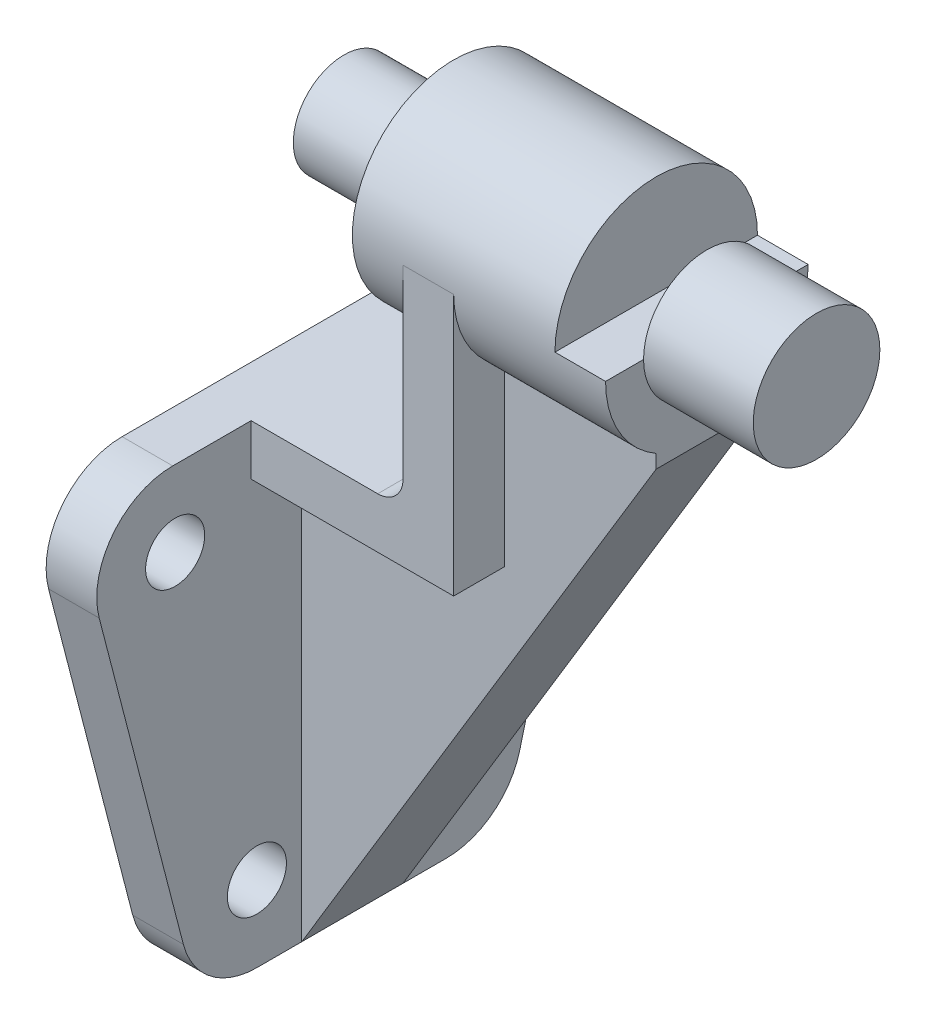
from build123d import *

# Parameters (mm, degrees)
SKETCH1_R                = 7
BOSS_EXTRUDE1_DEPTH      = 12
SKETCH2_R                = 24
BOSS_EXTRUDE2_DEPTH      = 48
BOSS_EXTRUDE3_DEPTH      = 12
SKETCH4_R                = 15
BOSS_EXTRUDE4_DEPTH      = 26
SKETCH5_R                = 12
BOSS_EXTRUDE5_DEPTH      = 26
BOSS_EXTRUDE6_DEPTH      = 24
BOSS_EXTRUDE6_DEPTH_BACK = 24
FILLET2_R                = 6
BOSS_EXTRUDE8_DEPTH      = 12
BOSS_EXTRUDE8_DEPTH_BACK = 12


with BuildPart() as part:
    # Sketch1 → Boss-Extrude1 (new body)
    with BuildSketch(Plane(origin=(0, 0, 0), x_dir=(0, 0, -1), z_dir=(1, 0, 0))):
        with BuildLine():
            Line((-59.995604766, 5.505634955), (-40.05091289, -71.438574032))
            ThreePointArc((-40.05091289, -71.438574032), (-33.642720476, -81.157532712), (-22.626759324, -84.92206293))
            Line((-22.626759324, -84.92206293), (22.246130308, -84.92206293))
            ThreePointArc((22.246130308, -84.92206293), (33.289539949, -81.136249628), (39.687584355, -71.371296652))
            Line((39.687584355, -71.371296652), (59.315693821, 5.572912335))
            ThreePointArc((59.315693821, 5.572912335), (56.088426472, 21.065555698), (41.874239774, 28.022146056))
            Line((41.874239774, 28.022146056), (-42.571451201, 28.022146056))
            ThreePointArc((-42.571451201, 28.022146056), (-56.806920983, 21.038107208), (-59.995604766, 5.505634955))
        make_face()
        with Locations((-42, 10.022146056)):
            Circle(SKETCH1_R, mode=Mode.SUBTRACT)
        with Locations((-22.626759324, -66.92206293)):
            Circle(SKETCH1_R, mode=Mode.SUBTRACT)
        with Locations((42, 10.022146056)):
            Circle(SKETCH1_R, mode=Mode.SUBTRACT)
        with Locations((22.626759324, -66.92206293)):
            Circle(SKETCH1_R, mode=Mode.SUBTRACT)
    extrude(amount=BOSS_EXTRUDE1_DEPTH)



with BuildPart() as body_2:
    # Sketch2 → Boss-Extrude2 (new body)
    with BuildSketch(Plane(origin=(36, 0, 0), x_dir=(0, 0, -1), z_dir=(1, 0, 0))):
        with Locations((0, 78.07793707)):
            Circle(SKETCH2_R)
    extrude(amount=BOSS_EXTRUDE2_DEPTH)

    # Sketch3 → Boss-Extrude3 (add)
    with BuildSketch(Plane(origin=(84, 0, 0), x_dir=(0, 0, -1), z_dir=(1, 0, 0))):
        with BuildLine():
            Line((-24, 78.07793707), (24, 78.07793707))
            ThreePointArc((24, 78.07793707), (0, 54.07793707), (-24, 78.07793707))
        make_face()
    extrude(amount=BOSS_EXTRUDE3_DEPTH)

    # Sketch4 → Boss-Extrude4 (add)
    with BuildSketch(Plane(origin=(96, 0, 0), x_dir=(0, 0, -1), z_dir=(1, 0, 0))):
        with Locations((0, 78.07793707)):
            Circle(SKETCH4_R)
    extrude(amount=BOSS_EXTRUDE4_DEPTH)

    # Sketch5 → Boss-Extrude5 (add)
    with BuildSketch(Plane.ZY.offset(-36)):
        with Locations((0, 78.07793707)):
            Circle(SKETCH5_R)
    extrude(amount=BOSS_EXTRUDE5_DEPTH)


with BuildPart() as part_1:
    add(part.part)

    add(body_2.part)  # Boss-Extrude6 merges body 2
    # Sketch6 → Boss-Extrude6 (add, two sides: drawn at the far end of the back side and taken through both)
    with BuildSketch(Plane.XY.offset(-BOSS_EXTRUDE6_DEPTH_BACK)):
        Polygon((12, 28.022146056), (48, 28.022146056), (48, 77.929166674), (60, 77.929166674), (60, 16.022146056), (12, 16.022146056), align=None)
    extrude(amount=BOSS_EXTRUDE6_DEPTH + BOSS_EXTRUDE6_DEPTH_BACK)

    # Fillet2
    fillet2_edges = [part_1.edges().sort_by_distance(p)[0] for p in [
        (48, 28.022146056, 0),
    ]]
    fillet(fillet2_edges, radius=FILLET2_R)

    # Sketch8 → Boss-Extrude8 (add, two sides: drawn at the far end of the back side and taken through both)
    with BuildSketch(Plane.XY.offset(-BOSS_EXTRUDE8_DEPTH_BACK)):
        Polygon((54, 16.022146056), (12, 16.022146056), (12, 5.505634955), (12, -84.92206293), (96, 54.07793707), (96, 78.07793707), (60, 77.929166674), (60, 54.07793707), (60, 22.022146056), (60, 16.022146056), align=None)
    extrude(amount=BOSS_EXTRUDE8_DEPTH + BOSS_EXTRUDE8_DEPTH_BACK)


solid = part_1.part
